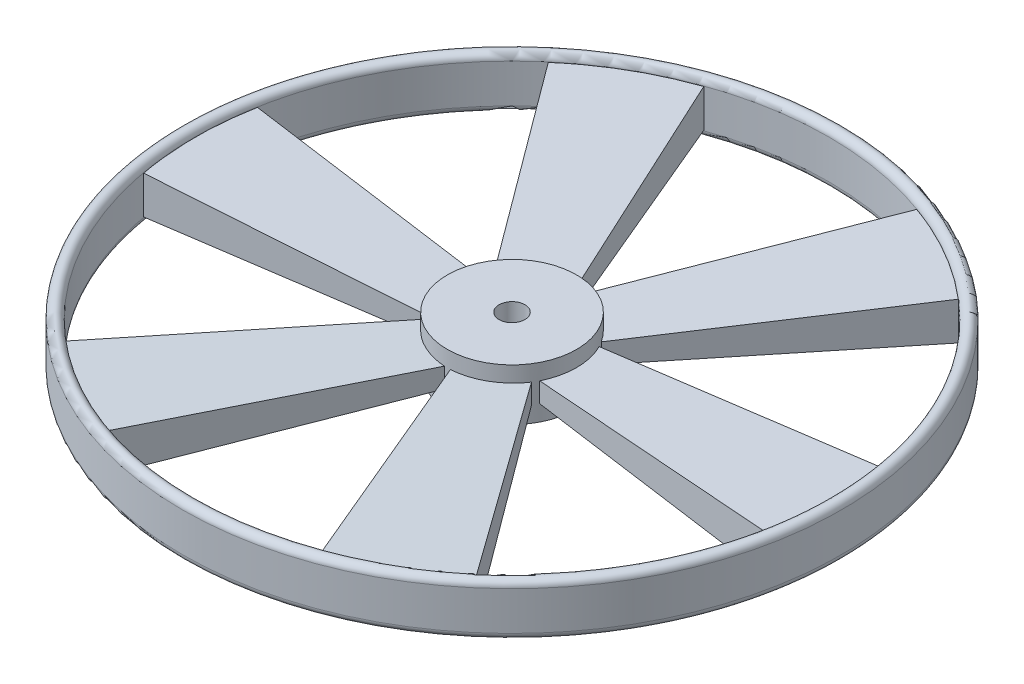
from build123d import *

# Parameters (mm, degrees)
BOSS_EXTRUDE1_DEPTH      = 2
BOSS_EXTRUDE1_DEPTH_BACK = 2
SKETCH2_R                = 5
CIRPATTERN1_COUNT        = 6
SKETCH5_R                = 1
CUT_EXTRUDE1_DEPTH       = 3


with BuildPart() as part:
    # Sketch1 → Revolve1 (revolve)
    with BuildSketch(Plane.XY):
        with BuildLine():
            Line((25.5, 1.5), (25.5, -1.5))
            ThreePointArc((25.5, -1.5), (25, -2), (24.5, -1.5))
            Line((24.5, -1.5), (24.5, 1.5))
            ThreePointArc((24.5, 1.5), (25, 2), (25.5, 1.5))
        make_face()
    revolve(axis=Axis((0, 4.258241229, 0), (0, -1, 0)))



with BuildPart() as body_2:
    # Sketch2 → Boss-Extrude1 (new, two sides: drawn at the far end of the back side and taken through both)
    with BuildSketch(Plane(origin=(0, 0, 0), x_dir=(1, 0, 0), z_dir=(0, 1, 0)).offset(-BOSS_EXTRUDE1_DEPTH_BACK)):
        Circle(SKETCH2_R)
    extrude(amount=BOSS_EXTRUDE1_DEPTH + BOSS_EXTRUDE1_DEPTH_BACK)


with BuildPart() as part_1:
    add(part.part)

    add(body_2.part)  # Loft1 merges body 2
    # Sketch4 → Loft1 section 0
    with BuildSketch(Plane(origin=(25, 0, 0), x_dir=(0, 0, -1), z_dir=(1, 0, 0))):
        with BuildLine():
            Line((4.5, -1.5), (-4.5, -1.5))
            Line((-4.5, -1.5), (-4.5, 1.5))
            Line((-4.5, 1.5), (4.5, 1.5))
            Line((4.5, 1.5), (4.5, -1.5))
        make_face()
    # Sketch3 → Loft1 section 1
    with BuildSketch(Plane(origin=(4, 0, 0), x_dir=(0, 0, -1), z_dir=(1, 0, 0))):
        with BuildLine():
            Line((2.25, -0.75), (-2.25, -0.75))
            Line((-2.25, -0.75), (-2.25, 0.75))
            Line((-2.25, 0.75), (2.25, 0.75))
            Line((2.25, 0.75), (2.25, -0.75))
        make_face()
    loft1 = loft()

    # CirPattern1: Loft1 ×6 about axis
    cirpattern1_axis = Axis((0, 2, 0), (0, 1, 0))
    for i in range(1, CIRPATTERN1_COUNT):
        add(loft1.rotate(cirpattern1_axis, i * 360 / CIRPATTERN1_COUNT))

    # Sketch5 → Cut-Extrude1 (cut)
    with BuildSketch(Plane(origin=(0, 2, 0), x_dir=(1, 0, 0), z_dir=(0, 1, 0))):
        Circle(SKETCH5_R)
    extrude(amount=-CUT_EXTRUDE1_DEPTH, mode=Mode.SUBTRACT)


solid = part_1.part
